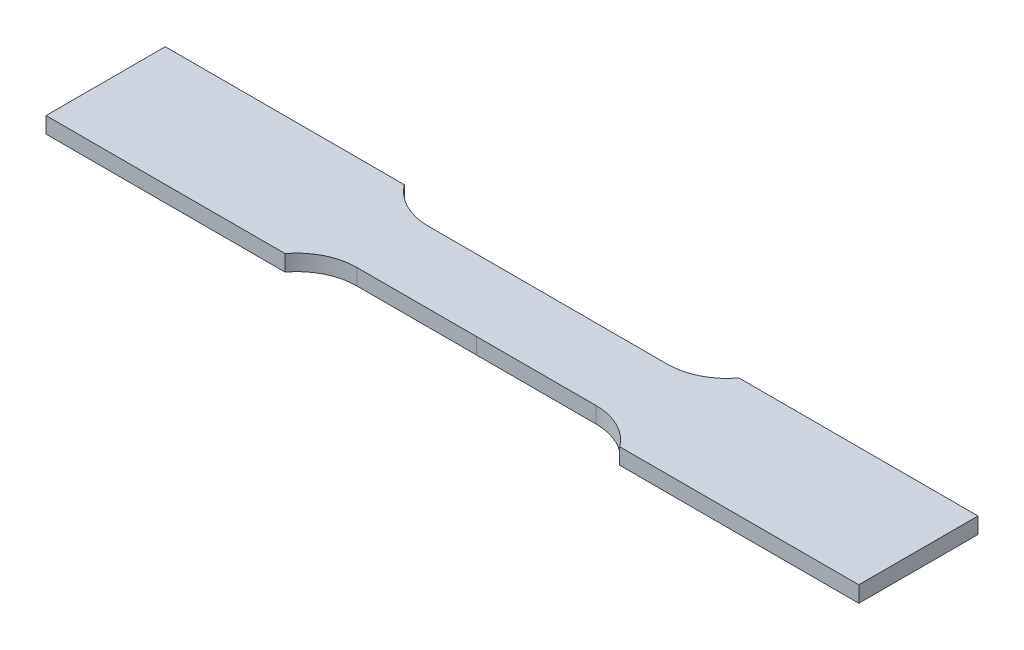
from build123d import *

# Parameters (mm, degrees)
BOSS_EXTRUDE2_DEPTH = 3.357


with BuildPart() as part:
    # Sketch1 → Boss-Extrude2 (new body)
    with BuildSketch(Plane(origin=(0, 0, 0), x_dir=(1, 0, 0), z_dir=(0, 1, 0))):
        with BuildLine():
            Line((35, 12.466667574), (85, 12.466667574))
            Line((85, 12.466667574), (85, -12.466667574))
            Line((85, -12.466667574), (35, -12.466667574))
            ThreePointArc((35, -12.466667574), (30.589688735, -8.788169755), (25, -7.47))
            Line((25, -7.47), (0, -7.475))
            Line((0, -7.475), (-25, -7.475))
            ThreePointArc((-25, -7.475), (-30.590169944, -8.794660113), (-35, -12.475))
            Line((-35, -12.475), (-85, -12.475))
            Line((-85, -12.475), (-85, 12.475))
            Line((-85, 12.475), (-35, 12.475))
            ThreePointArc((-35, 12.475), (-30.590169944, 8.794660113), (-25, 7.475))
            Line((-25, 7.475), (0, 7.475))
            Line((0, 7.475), (25, 7.47))
            ThreePointArc((25, 7.47), (30.589688735, 8.788169755), (35, 12.466667574))
        make_face()
    extrude(amount=BOSS_EXTRUDE2_DEPTH)


solid = part.part
